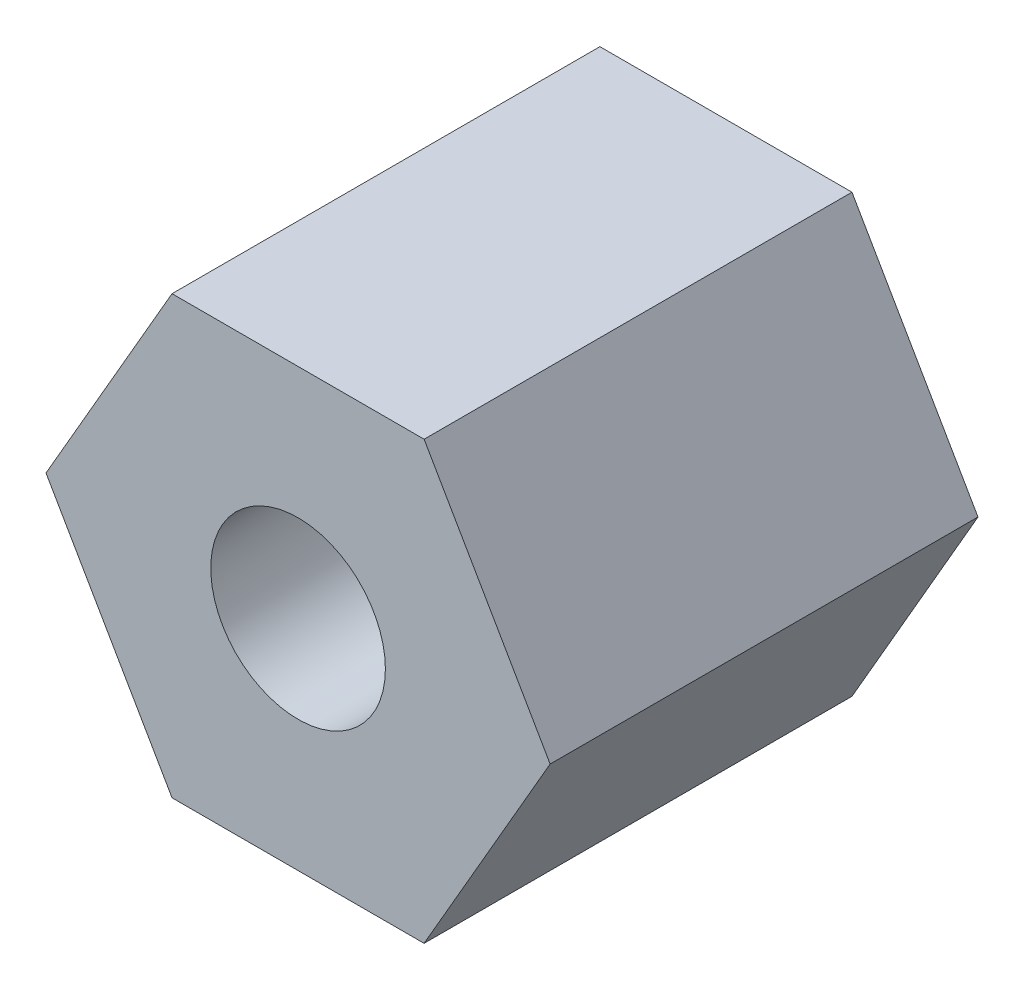
from build123d import *

# Parameters (mm, degrees)
SKETCH_1_R      = 2
EXTRUDE_1_DEPTH = 9.8


with BuildPart() as part:
    # 草图1 → 凸台-拉伸1 (new body)
    with BuildSketch(Plane.XY):
        Polygon((2.886751346, -5), (5.773502692, 0), (2.886751346, 5), (-2.886751346, 5), (-5.773502692, 0), (-2.886751346, -5), align=None)
        Circle(SKETCH_1_R, mode=Mode.SUBTRACT)
    extrude(amount=EXTRUDE_1_DEPTH)


solid = part.part
